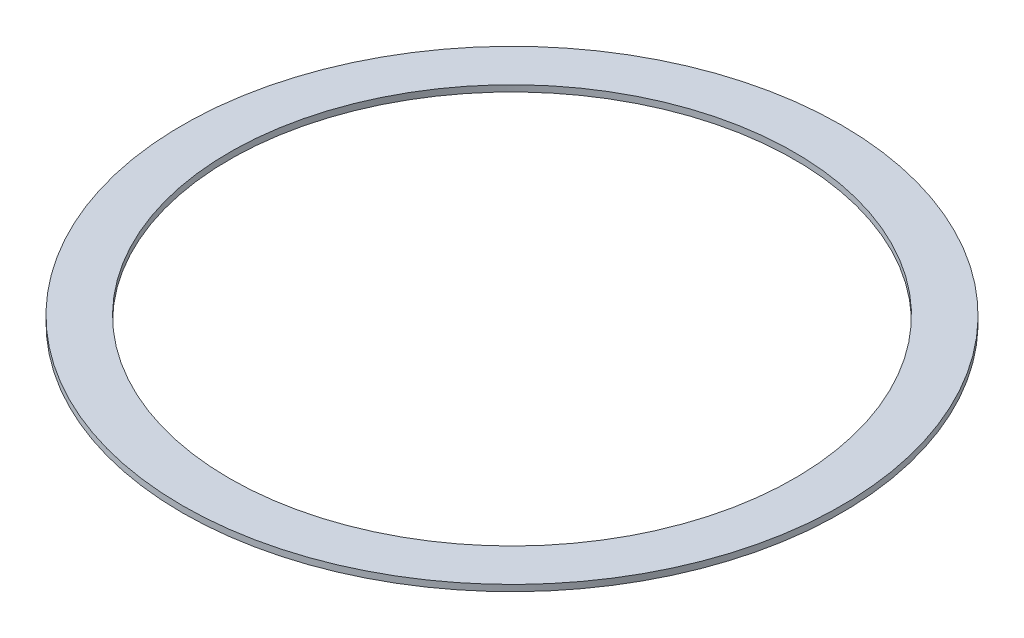
from build123d import *

# Parameters (mm, degrees)
ESBO_O1_R                = 52.5
ESBO_O1_R_2              = 45
RESSALTO_EXTRUS_O1_DEPTH = 1


with BuildPart() as part:
    # Esboço1 → Ressalto-extrusão1 (new body)
    with BuildSketch(Plane(origin=(0, 0, 0), x_dir=(1, 0, 0), z_dir=(0, 1, 0))):
        with Locations(Location((0, 0, 0), (0, 0, 270))):
            Circle(ESBO_O1_R)
        with Locations(Location((0, 0, 0), (0, 0, 270))):
            Circle(ESBO_O1_R_2, mode=Mode.SUBTRACT)
    extrude(amount=RESSALTO_EXTRUS_O1_DEPTH)


solid = part.part
